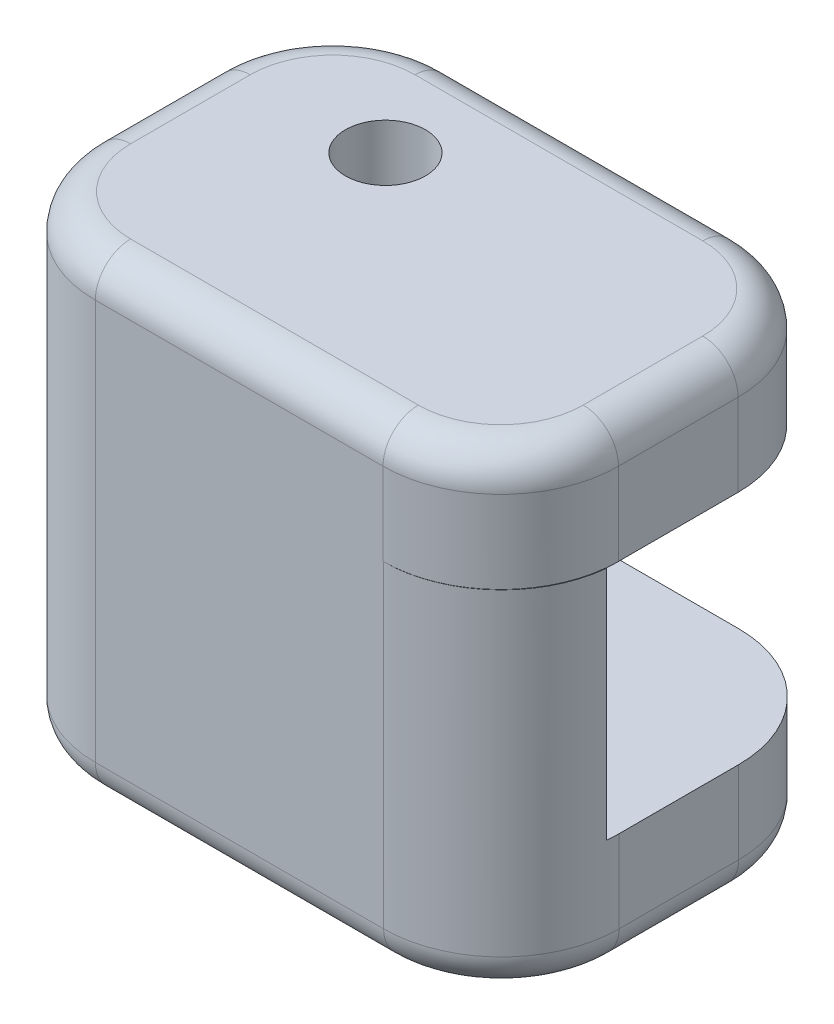
from build123d import *

# Parameters (mm, degrees)
SKETCH1_R           = 1.7
BOSS_EXTRUDE1_DEPTH = 5
BOSS_EXTRUDE2_DEPTH = 10
SKETCH3_W           = 22.216419783
SKETCH3_H           = 5.578122697
CUT_EXTRUDE1_DEPTH  = 7
SKETCH4_R           = 1.7
BOSS_EXTRUDE3_DEPTH = 5
CUT_EXTRUDE2_DEPTH  = 2.6
FILLET1_R           = 1.5


with BuildPart() as part:
    # Sketch1 → Boss-Extrude1 (new body)
    with BuildSketch(Plane(origin=(0, 0, 0), x_dir=(1, 0, 0), z_dir=(0, 1, 0))):
        with BuildLine():
            Line((0, 5), (10, 5))
            ThreePointArc((10, 5), (13.535533906, 3.535533906), (15, 0))
            Line((15, 0), (15, -5.078122697))
            ThreePointArc((15, -5.078122697), (13.535533906, -8.613656603), (10, -10.078122697))
            Line((10, -10.078122697), (-2.241482597, -10.078122697))
            ThreePointArc((-2.241482597, -10.078122697), (-5.777016503, -8.613656603), (-7.241482597, -5.078122697))
            Line((-7.241482597, -5.078122697), (-7.241482597, 0))
            ThreePointArc((-7.241482597, 0), (-5.777016503, 3.535533906), (-2.241482597, 5))
            Line((-2.241482597, 5), (0, 5))
        make_face()
        with Locations(Location((0, 0, 0), (0, 0, 270))):
            Circle(SKETCH1_R, mode=Mode.SUBTRACT)
    extrude(amount=BOSS_EXTRUDE1_DEPTH)

    # Sketch2 → Boss-Extrude2 (add)
    with BuildSketch(Plane(origin=(0, 5, 0), x_dir=(1, 0, 0), z_dir=(0, 1, 0))):
        with BuildLine():
            Line((-5.578122697, 0), (-7.241482597, 0))
            Line((-7.241482597, 0), (-7.241482597, -5.078122697))
            ThreePointArc((-7.241482597, -5.078122697), (-5.777016503, -8.613656603), (-2.241482597, -10.078122697))
            Line((-2.241482597, -10.078122697), (10, -10.078122697))
            ThreePointArc((10, -10.078122697), (13.354101966, -8.78622194), (14.974937186, -5.578122697))
            Line((14.974937186, -5.578122697), (0, -5.578122697))
            ThreePointArc((0, -5.578122697), (-3.944328385, -3.944328385), (-5.578122697, 0))
        make_face()
    extrude(amount=BOSS_EXTRUDE2_DEPTH)

    # Sketch3 → Cut-Extrude1 (cut)
    with BuildSketch(Plane(origin=(0, 15, 0), x_dir=(1, 0, 0), z_dir=(0, 1, 0))):
        with Locations((3.866727295, -2.789061349)):
            Rectangle(SKETCH3_W, SKETCH3_H)
    extrude(amount=-CUT_EXTRUDE1_DEPTH, mode=Mode.SUBTRACT)

    # Sketch4 → Boss-Extrude3 (add)
    with BuildSketch(Plane(origin=(0, 15, 0), x_dir=(1, 0, 0), z_dir=(0, 1, 0))):
        with BuildLine():
            Line((-2.241482597, 5), (9.974937186, 5))
            ThreePointArc((9.974937186, 5), (13.510471091, 3.535533906), (14.974937186, 0))
            Line((14.974937186, 0), (14.974937186, -5.078122697))
            ThreePointArc((14.974937186, -5.078122697), (13.510471091, -8.613656603), (9.974937186, -10.078122697))
            Line((9.974937186, -10.078122697), (-2.241482597, -10.078122697))
            ThreePointArc((-2.241482597, -10.078122697), (-5.777016503, -8.613656603), (-7.241482597, -5.078122697))
            Line((-7.241482597, -5.078122697), (-7.241482597, 0))
            ThreePointArc((-7.241482597, 0), (-5.777016503, 3.535533906), (-2.241482597, 5))
        make_face()
        with Locations(Location((0, 0, 0), (0, 0, 270))):
            Circle(SKETCH4_R, mode=Mode.SUBTRACT)
    extrude(amount=BOSS_EXTRUDE3_DEPTH)

    # Sketch5 → Cut-Extrude2 (cut)
    with BuildSketch(Plane.XZ):
        Polygon((3.233161507, 0), (1.616580754, 2.8), (-1.616580754, 2.8), (-3.233161507, 0), (-1.616580754, -2.8), (1.616580754, -2.8), align=None)
    extrude(amount=-CUT_EXTRUDE2_DEPTH, mode=Mode.SUBTRACT)

    # Fillet1
    fillet1_edges = [part.edges().sort_by_distance(p)[0] for p in [
        (15, 0, 2.539061348),
        (13.535533906, 0, 8.613656603),
        (3.879258701, 0, 10.078122697),
        (-5.777016503, 0, 8.613656603),
        (-7.241482597, 0, 2.539061348),
        (-5.777016503, 0, -3.535533906),
        (13.510471091, 20, 8.613656603),
        (14.974937186, 20, 2.539061348),
        (13.510471091, 20, -3.535533906),
        (3.866727294, 20, -5),
        (-5.777016503, 20, -3.535533906),
        (-7.241482597, 20, 2.539061348),
        (-5.777016503, 20, 8.613656603),
        (3.866727294, 20, 10.078122697),
        (3.879258701, 0, -5),
        (13.535533906, 0, -3.535533906),
    ]]
    fillet(fillet1_edges, radius=FILLET1_R)


solid = part.part
